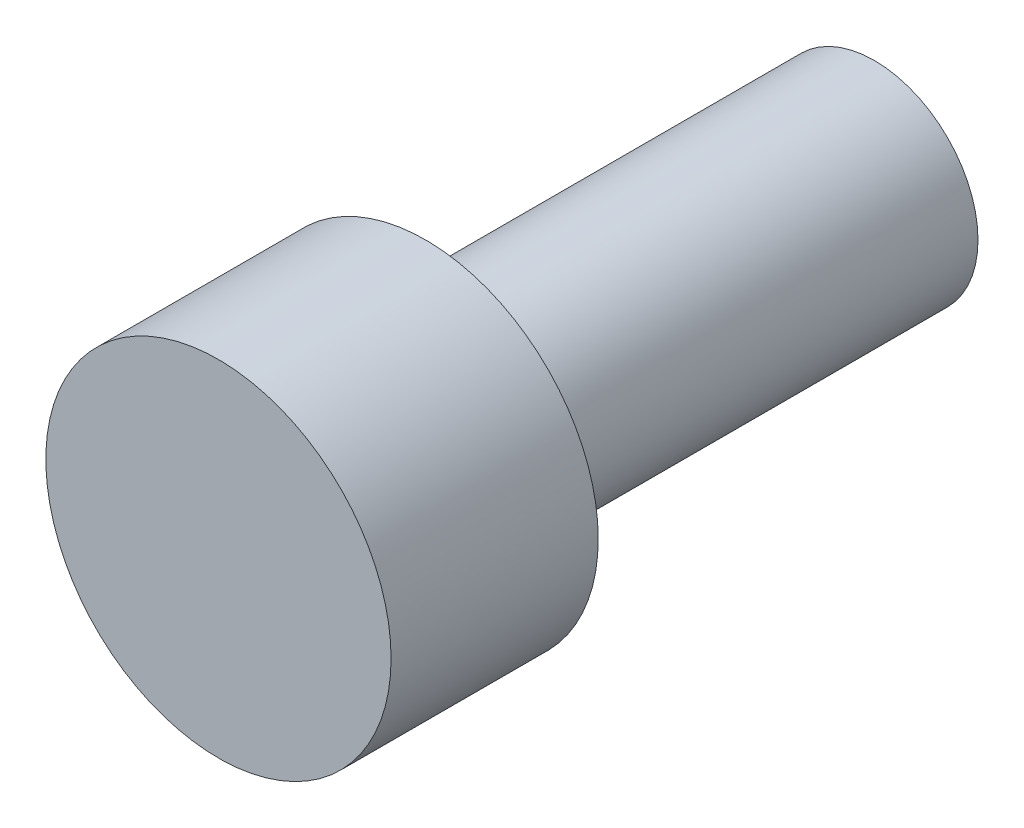
from build123d import *


with BuildPart() as part:
    # 草图1 → 旋转1 (revolve)
    with BuildSketch(Plane(origin=(0, 0, 0), x_dir=(1, 0, 0), z_dir=(0, 1, 0)), mode=Mode.PRIVATE) as revolve_1_sk:
        Polygon((-2.85625, 18.7), (-5.85625, 18.7), (-5.85625, 5.7), (-7.85625, 5.7), (-7.85625, -0.3), (-2.85625, -0.3), align=None)
    revolve(revolve_1_sk.sketch.rotate(Axis((-2.85625, 0, 0), (0, 0, -1)), 180), axis=Axis((-2.85625, 0, 0), (0, 0, -1)))


solid = part.part
